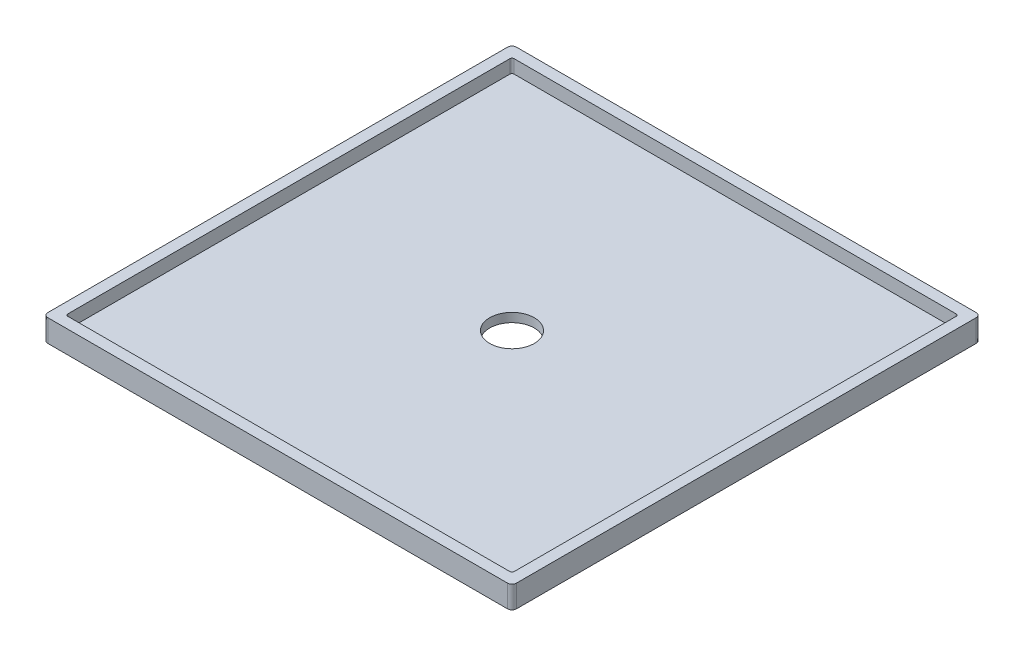
from build123d import *

# Parameters (mm, degrees)
SKETCH1_W           = 105
SKETCH1_H           = 105
BOSS_EXTRUDE1_DEPTH = 5
SKETCH2_R           = 5
CUT_EXTRUDE1_DEPTH  = 5
CUT_EXTRUDE2_DEPTH  = 3
FILLET1_R           = 1


with BuildPart() as part:
    # Sketch1 → Boss-Extrude1 (new body)
    with BuildSketch(Plane(origin=(0, 0, 0), x_dir=(1, 0, 0), z_dir=(0, 1, 0))):
        Rectangle(SKETCH1_W, SKETCH1_H)
    extrude(amount=BOSS_EXTRUDE1_DEPTH)

    # Sketch2 → Cut-Extrude1 (cut)
    with BuildSketch(Plane(origin=(0, 5, 0), x_dir=(1, 0, 0), z_dir=(0, 1, 0))):
        with Locations(Location((0, 0, 0), (0, 0, 270))):
            Circle(SKETCH2_R)
    extrude(amount=-CUT_EXTRUDE1_DEPTH, mode=Mode.SUBTRACT)

    # Sketch3 → Cut-Extrude2 (cut)
    with BuildSketch(Plane(origin=(0, 5, 0), x_dir=(1, 0, 0), z_dir=(0, 1, 0))):
        with BuildLine():
            Line((-49.5, -50), (49.5, -50))
            ThreePointArc((49.5, -50), (49.853553391, -49.853553391), (50, -49.5))
            Line((50, -49.5), (50, 49.5))
            ThreePointArc((50, 49.5), (49.853553391, 49.853553391), (49.5, 50))
            Line((49.5, 50), (-49.5, 50))
            ThreePointArc((-49.5, 50), (-49.853553391, 49.853553391), (-50, 49.5))
            Line((-50, 49.5), (-50, -49.5))
            ThreePointArc((-50, -49.5), (-49.853553391, -49.853553391), (-49.5, -50))
        make_face()
    extrude(amount=-CUT_EXTRUDE2_DEPTH, mode=Mode.SUBTRACT)

    # Fillet1
    fillet1_edges = [part.edges().sort_by_distance(p)[0] for p in [
        (52.5, 2.5, 52.5),
        (-52.5, 2.5, 52.5),
        (-52.5, 2.5, -52.5),
        (52.5, 2.5, -52.5),
    ]]
    fillet(fillet1_edges, radius=FILLET1_R)


solid = part.part
